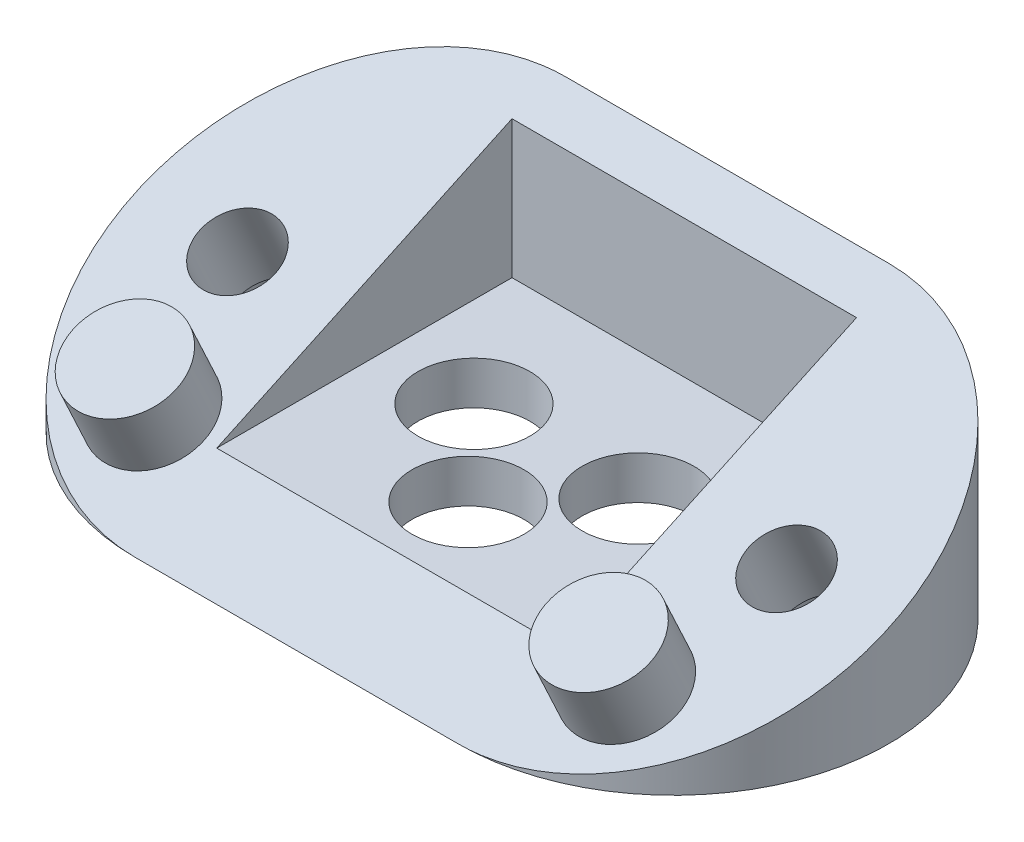
from build123d import *

# Parameters (mm, degrees)
SKETCH1_R               = 2.6
BOSS_EXTRUDE3_DEPTH     = 20
SKETCH2_W               = 16
SKETCH2_H               = 16
CUT_EXTRUDE1_DEPTH      = 18
CUT_EXTRUDE2_DEPTH      = 34.915335764
CUT_EXTRUDE2_DEPTH_BACK = 34.915335764
CUT_EXTRUDE3_DEPTH      = 22.802901488
CUT_EXTRUDE3_DEPTH_BACK = 22.802901488
SKETCH5_R               = 1.75
SKETCH7_R               = 2.5
SKETCH7_R_2             = 1.75
BOSS_EXTRUDE4_DEPTH     = 4
CUT_EXTRUDE6_START      = -6.310905
SKETCH7_5_R             = 2.5
SKETCH7_5_R_2           = 1.75
CUT_EXTRUDE6_DEPTH      = 2.310905
SKETCH9_R               = 2.4
BOSS_EXTRUDE5_DEPTH     = 3


with BuildPart() as part:
    # Sketch1 → Boss-Extrude3 (new body)
    with BuildSketch(Plane(origin=(0, 0, 0), x_dir=(1, 0, 0), z_dir=(0, 1, 0))):
        with BuildLine():
            Line((-7.5, 10), (7.5, 10))
            ThreePointArc((7.5, 10), (17.5, 0), (7.5, -10))
            Line((7.5, -10), (-7.5, -10))
            ThreePointArc((-7.5, -10), (-17.5, 0), (-7.5, 10))
        make_face()
        with Locations(Location((-3.81, 2.042862393, 0), (0, 0, 270))):
            Circle(SKETCH1_R, mode=Mode.SUBTRACT)
        with Locations(Location((3.81, 2.042862393, 0), (0, 0, 270))):
            Circle(SKETCH1_R, mode=Mode.SUBTRACT)
        with Locations(Location((0, -2.042862393, 0), (0, 0, 270))):
            Circle(SKETCH1_R, mode=Mode.SUBTRACT)
    extrude(amount=BOSS_EXTRUDE3_DEPTH)

    # Sketch2 → Cut-Extrude1 (cut)
    with BuildSketch(Plane(origin=(0, 20, 0), x_dir=(1, 0, 0), z_dir=(0, 1, 0))):
        Rectangle(SKETCH2_W, SKETCH2_H)
    extrude(amount=-CUT_EXTRUDE1_DEPTH, mode=Mode.SUBTRACT)

    # Sketch4 → Cut-Extrude2 (cut, two sides: drawn at the far end of the back side and taken through both)
    with BuildSketch(Plane(origin=(-8, 0, 0), x_dir=(0, 0, -1), z_dir=(1, 0, 0)).offset(-CUT_EXTRUDE2_DEPTH_BACK)):
        Polygon((-8, 2), (-5.710986159, 2), (8, 8.393537847), (8, 20), (-8, 20), align=None)
        Polygon((8, 20), (8, 8.393537847), (10, 9.326153163), (10, 20), align=None)
        Polygon((-10, 20), (-10, 0), (-5.710986159, 2), (-8, 2), (-8, 20), align=None)
    extrude(amount=CUT_EXTRUDE2_DEPTH + CUT_EXTRUDE2_DEPTH_BACK, mode=Mode.SUBTRACT)

    # Sketch5 → Cut-Extrude3 (cut, two sides: drawn at the far end of the back side and taken through both)
    with BuildSketch(Plane(origin=(0, 3.830222216, 1.786061952), x_dir=(1, 0, 0), z_dir=(0, 0.9063077870366478, 0.42261826174070405)).offset(-CUT_EXTRUDE3_DEPTH_BACK)):
        with Locations(Location((-12.75, 1.970701319, 0), (0, 0, 270))):
            Circle(SKETCH5_R)
        with Locations(Location((12.75, 1.970701319, 0), (0, 0, 270))):
            Circle(SKETCH5_R)
    extrude(amount=CUT_EXTRUDE3_DEPTH + CUT_EXTRUDE3_DEPTH_BACK, mode=Mode.SUBTRACT)

    # Sketch7 → Boss-Extrude4 (add)
    # profile 1 of 2: a face of its own
    with BuildSketch(Plane(origin=(0, 3.830222216, 1.786061952), x_dir=(1, 0, 0), z_dir=(0, 0.9063077870366478, 0.42261826174070405))):
        with Locations((-12.75, 1.970701319)):
            Circle(SKETCH7_R)
        with Locations(Location((-12.75, 1.970701319, 0), (0, 0, 270))):
            Circle(SKETCH7_R_2, mode=Mode.SUBTRACT)
    # profile 2 of 2: a face of its own
    with BuildSketch(Plane(origin=(0, 3.830222216, 1.786061952), x_dir=(1, 0, 0), z_dir=(0, 0.9063077870366478, 0.42261826174070405))):
        with Locations((12.75, 1.970701319)):
            Circle(SKETCH7_R)
        with Locations(Location((12.75, 1.970701319, 0), (0, 0, 270))):
            Circle(SKETCH7_R_2, mode=Mode.SUBTRACT)
    extrude(amount=-BOSS_EXTRUDE4_DEPTH)

    # Sketch7<5> → Cut-Extrude6 (cut)
    # profile 1 of 2: a face of its own
    with BuildSketch(Plane(origin=(0, 3.830222216, 1.786061952), x_dir=(1, 0, 0), z_dir=(0, 0.9063077870366478, 0.42261826174070405)).offset(CUT_EXTRUDE6_START)):
        with Locations((-12.75, 1.970701319)):
            Circle(SKETCH7_5_R)
        with Locations(Location((-12.75, 1.970701319, 0), (0, 0, 270))):
            Circle(SKETCH7_5_R_2, mode=Mode.SUBTRACT)
    # profile 2 of 2: a face of its own
    with BuildSketch(Plane(origin=(0, 3.830222216, 1.786061952), x_dir=(1, 0, 0), z_dir=(0, 0.9063077870366478, 0.42261826174070405)).offset(CUT_EXTRUDE6_START)):
        with Locations((12.75, 1.970701319)):
            Circle(SKETCH7_5_R)
        with Locations(Location((12.75, 1.970701319, 0), (0, 0, 270))):
            Circle(SKETCH7_5_R_2, mode=Mode.SUBTRACT)
    extrude(amount=CUT_EXTRUDE6_DEPTH, mode=Mode.SUBTRACT)

    # Sketch9 → Boss-Extrude5 (add)
    with BuildSketch(Plane(origin=(0, 3.830222216, 1.786061952), x_dir=(1, 0, 0), z_dir=(0, 0.9063077870366478, 0.4226182617407042))):
        with Locations(Location((-11, -4.330674704, 0), (0, 0, 90))):
            Circle(SKETCH9_R)
        with Locations(Location((11, -4.330674704, 0), (0, 0, 90))):
            Circle(SKETCH9_R)
    extrude(amount=BOSS_EXTRUDE5_DEPTH)


solid = part.part
